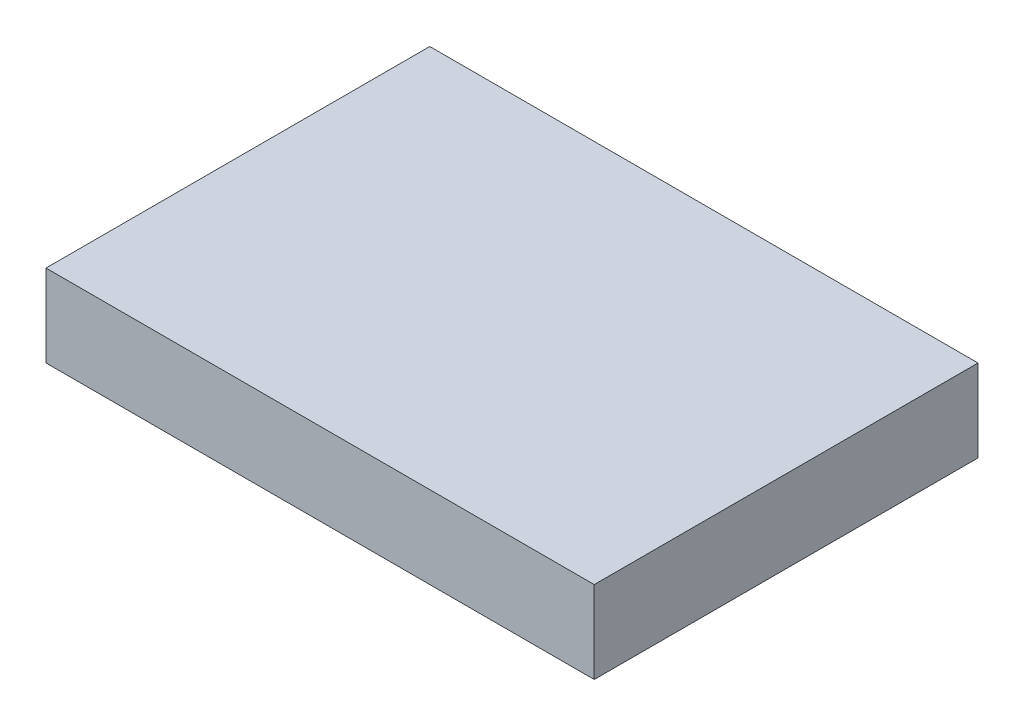
from build123d import *

# Parameters (mm, degrees)
SKETCH1_W           = 100
SKETCH1_H           = 70
BOSS_EXTRUDE1_DEPTH = 15


with BuildPart() as part:
    # Sketch1 → Boss-Extrude1 (new body)
    with BuildSketch(Plane(origin=(0, 0, 0), x_dir=(1, 0, 0), z_dir=(0, 1, 0))):
        Rectangle(SKETCH1_W, SKETCH1_H)
    extrude(amount=BOSS_EXTRUDE1_DEPTH)


solid = part.part
